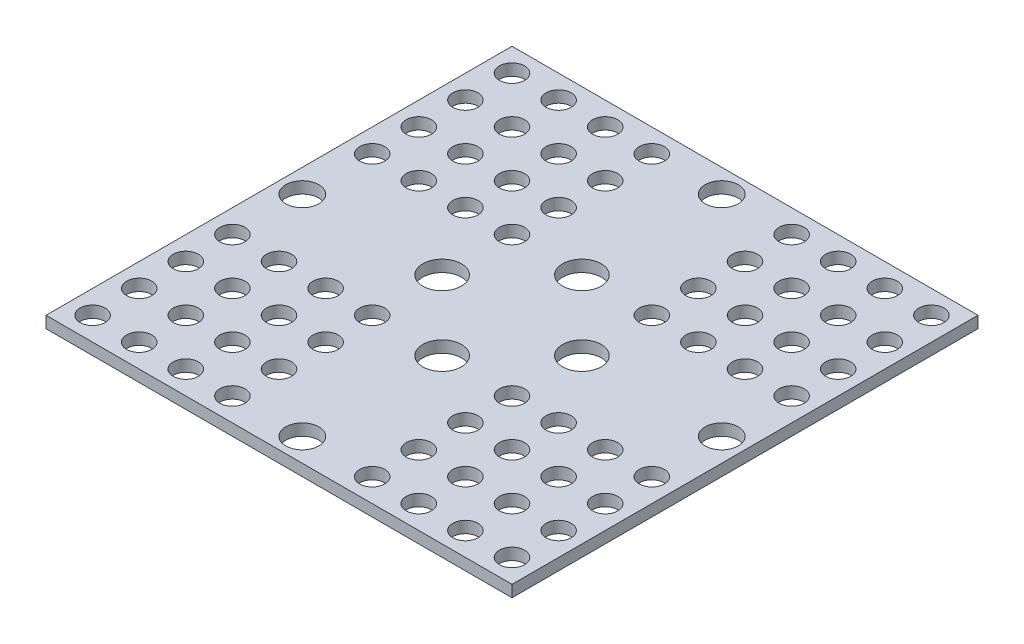
from build123d import *

# Parameters (mm, degrees)
SKETCH1_W           = 127
SKETCH1_H           = 127
SKETCH1_R           = 5.272810933
SKETCH1_R_2         = 4.510308164
SKETCH1_R_3         = 3.429
BOSS_EXTRUDE1_DEPTH = 3.175


with BuildPart() as part:
    # Sketch1 → Boss-Extrude1 (new body)
    with BuildSketch(Plane(origin=(0, 0, 0), x_dir=(1, 0, 0), z_dir=(0, 1, 0))):
        Rectangle(SKETCH1_W, SKETCH1_H)
        with Locations(Location((0, 19.05, 0), (0, 0, 270))):
            Circle(SKETCH1_R, mode=Mode.SUBTRACT)
        with Locations(Location((0, 57.15, 0), (0, 0, 270))):
            Circle(SKETCH1_R_2, mode=Mode.SUBTRACT)
        with Locations(Location((57.15, 0, 0), (0, 0, 90))):
            Circle(SKETCH1_R_2, mode=Mode.SUBTRACT)
        with Locations(Location((19.05, 0, 0), (0, 0, 90))):
            Circle(SKETCH1_R, mode=Mode.SUBTRACT)
        with Locations(Location((0, -19.05, 0), (0, 0, 270))):
            Circle(SKETCH1_R, mode=Mode.SUBTRACT)
        with Locations(Location((0, -57.15, 0), (0, 0, 270))):
            Circle(SKETCH1_R_2, mode=Mode.SUBTRACT)
        with Locations(Location((-57.15, 0, 0), (0, 0, 90))):
            Circle(SKETCH1_R_2, mode=Mode.SUBTRACT)
        with Locations(Location((-19.05, 0, 0), (0, 0, 90))):
            Circle(SKETCH1_R, mode=Mode.SUBTRACT)
        with Locations(Location((-57.15, 57.15, 0), (0, 0, 270))):
            Circle(SKETCH1_R_3, mode=Mode.SUBTRACT)
        with Locations(Location((-44.45, 57.15, 0), (0, 0, 270))):
            Circle(SKETCH1_R_3, mode=Mode.SUBTRACT)
        with Locations(Location((-31.75, 57.15, 0), (0, 0, 270))):
            Circle(SKETCH1_R_3, mode=Mode.SUBTRACT)
        with Locations(Location((-19.05, 57.15, 0), (0, 0, 270))):
            Circle(SKETCH1_R_3, mode=Mode.SUBTRACT)
        with Locations(Location((19.05, 57.15, 0), (0, 0, 270))):
            Circle(SKETCH1_R_3, mode=Mode.SUBTRACT)
        with Locations(Location((31.75, 57.15, 0), (0, 0, 270))):
            Circle(SKETCH1_R_3, mode=Mode.SUBTRACT)
        with Locations(Location((44.45, 57.15, 0), (0, 0, 270))):
            Circle(SKETCH1_R_3, mode=Mode.SUBTRACT)
        with Locations(Location((57.15, 57.15, 0), (0, 0, 270))):
            Circle(SKETCH1_R_3, mode=Mode.SUBTRACT)
        with Locations(Location((-44.45, 44.45, 0), (0, 0, 270))):
            Circle(SKETCH1_R_3, mode=Mode.SUBTRACT)
        with Locations(Location((-31.75, 44.45, 0), (0, 0, 270))):
            Circle(SKETCH1_R_3, mode=Mode.SUBTRACT)
        with Locations(Location((-19.05, 44.45, 0), (0, 0, 270))):
            Circle(SKETCH1_R_3, mode=Mode.SUBTRACT)
        with Locations(Location((19.05, 44.45, 0), (0, 0, 270))):
            Circle(SKETCH1_R_3, mode=Mode.SUBTRACT)
        with Locations(Location((31.75, 44.45, 0), (0, 0, 270))):
            Circle(SKETCH1_R_3, mode=Mode.SUBTRACT)
        with Locations(Location((44.45, 44.45, 0), (0, 0, 270))):
            Circle(SKETCH1_R_3, mode=Mode.SUBTRACT)
        with Locations(Location((57.15, 44.45, 0), (0, 0, 270))):
            Circle(SKETCH1_R_3, mode=Mode.SUBTRACT)
        with Locations(Location((-44.45, 31.75, 0), (0, 0, 270))):
            Circle(SKETCH1_R_3, mode=Mode.SUBTRACT)
        with Locations(Location((-31.75, 31.75, 0), (0, 0, 270))):
            Circle(SKETCH1_R_3, mode=Mode.SUBTRACT)
        with Locations(Location((-19.05, 31.75, 0), (0, 0, 270))):
            Circle(SKETCH1_R_3, mode=Mode.SUBTRACT)
        with Locations(Location((19.05, 31.75, 0), (0, 0, 270))):
            Circle(SKETCH1_R_3, mode=Mode.SUBTRACT)
        with Locations(Location((31.75, 31.75, 0), (0, 0, 270))):
            Circle(SKETCH1_R_3, mode=Mode.SUBTRACT)
        with Locations(Location((44.45, 31.75, 0), (0, 0, 270))):
            Circle(SKETCH1_R_3, mode=Mode.SUBTRACT)
        with Locations(Location((57.15, 31.75, 0), (0, 0, 270))):
            Circle(SKETCH1_R_3, mode=Mode.SUBTRACT)
        with Locations(Location((-44.45, 19.05, 0), (0, 0, 270))):
            Circle(SKETCH1_R_3, mode=Mode.SUBTRACT)
        with Locations(Location((-31.75, 19.05, 0), (0, 0, 270))):
            Circle(SKETCH1_R_3, mode=Mode.SUBTRACT)
        with Locations(Location((-19.05, 19.05, 0), (0, 0, 270))):
            Circle(SKETCH1_R_3, mode=Mode.SUBTRACT)
        with Locations(Location((19.05, 19.05, 0), (0, 0, 270))):
            Circle(SKETCH1_R_3, mode=Mode.SUBTRACT)
        with Locations(Location((31.75, 19.05, 0), (0, 0, 270))):
            Circle(SKETCH1_R_3, mode=Mode.SUBTRACT)
        with Locations(Location((44.45, 19.05, 0), (0, 0, 270))):
            Circle(SKETCH1_R_3, mode=Mode.SUBTRACT)
        with Locations(Location((57.15, 19.05, 0), (0, 0, 270))):
            Circle(SKETCH1_R_3, mode=Mode.SUBTRACT)
        with Locations(Location((-44.45, -19.05, 0), (0, 0, 270))):
            Circle(SKETCH1_R_3, mode=Mode.SUBTRACT)
        with Locations(Location((-31.75, -19.05, 0), (0, 0, 270))):
            Circle(SKETCH1_R_3, mode=Mode.SUBTRACT)
        with Locations(Location((-19.05, -19.05, 0), (0, 0, 270))):
            Circle(SKETCH1_R_3, mode=Mode.SUBTRACT)
        with Locations(Location((19.05, -19.05, 0), (0, 0, 270))):
            Circle(SKETCH1_R_3, mode=Mode.SUBTRACT)
        with Locations(Location((31.75, -19.05, 0), (0, 0, 270))):
            Circle(SKETCH1_R_3, mode=Mode.SUBTRACT)
        with Locations(Location((44.45, -19.05, 0), (0, 0, 270))):
            Circle(SKETCH1_R_3, mode=Mode.SUBTRACT)
        with Locations(Location((57.15, -19.05, 0), (0, 0, 270))):
            Circle(SKETCH1_R_3, mode=Mode.SUBTRACT)
        with Locations(Location((-44.45, -31.75, 0), (0, 0, 270))):
            Circle(SKETCH1_R_3, mode=Mode.SUBTRACT)
        with Locations(Location((-31.75, -31.75, 0), (0, 0, 270))):
            Circle(SKETCH1_R_3, mode=Mode.SUBTRACT)
        with Locations(Location((-19.05, -31.75, 0), (0, 0, 270))):
            Circle(SKETCH1_R_3, mode=Mode.SUBTRACT)
        with Locations(Location((19.05, -31.75, 0), (0, 0, 270))):
            Circle(SKETCH1_R_3, mode=Mode.SUBTRACT)
        with Locations(Location((31.75, -31.75, 0), (0, 0, 270))):
            Circle(SKETCH1_R_3, mode=Mode.SUBTRACT)
        with Locations(Location((44.45, -31.75, 0), (0, 0, 270))):
            Circle(SKETCH1_R_3, mode=Mode.SUBTRACT)
        with Locations(Location((57.15, -31.75, 0), (0, 0, 270))):
            Circle(SKETCH1_R_3, mode=Mode.SUBTRACT)
        with Locations(Location((-44.45, -44.45, 0), (0, 0, 270))):
            Circle(SKETCH1_R_3, mode=Mode.SUBTRACT)
        with Locations(Location((-31.75, -44.45, 0), (0, 0, 270))):
            Circle(SKETCH1_R_3, mode=Mode.SUBTRACT)
        with Locations(Location((-19.05, -44.45, 0), (0, 0, 270))):
            Circle(SKETCH1_R_3, mode=Mode.SUBTRACT)
        with Locations(Location((19.05, -44.45, 0), (0, 0, 270))):
            Circle(SKETCH1_R_3, mode=Mode.SUBTRACT)
        with Locations(Location((31.75, -44.45, 0), (0, 0, 270))):
            Circle(SKETCH1_R_3, mode=Mode.SUBTRACT)
        with Locations(Location((44.45, -44.45, 0), (0, 0, 270))):
            Circle(SKETCH1_R_3, mode=Mode.SUBTRACT)
        with Locations(Location((57.15, -44.45, 0), (0, 0, 270))):
            Circle(SKETCH1_R_3, mode=Mode.SUBTRACT)
        with Locations(Location((-44.45, -57.15, 0), (0, 0, 270))):
            Circle(SKETCH1_R_3, mode=Mode.SUBTRACT)
        with Locations(Location((-31.75, -57.15, 0), (0, 0, 270))):
            Circle(SKETCH1_R_3, mode=Mode.SUBTRACT)
        with Locations(Location((-19.05, -57.15, 0), (0, 0, 270))):
            Circle(SKETCH1_R_3, mode=Mode.SUBTRACT)
        with Locations(Location((19.05, -57.15, 0), (0, 0, 270))):
            Circle(SKETCH1_R_3, mode=Mode.SUBTRACT)
        with Locations(Location((31.75, -57.15, 0), (0, 0, 270))):
            Circle(SKETCH1_R_3, mode=Mode.SUBTRACT)
        with Locations(Location((44.45, -57.15, 0), (0, 0, 270))):
            Circle(SKETCH1_R_3, mode=Mode.SUBTRACT)
        with Locations(Location((57.15, -57.15, 0), (0, 0, 270))):
            Circle(SKETCH1_R_3, mode=Mode.SUBTRACT)
        with Locations(Location((-57.15, 44.45, 0), (0, 0, 270))):
            Circle(SKETCH1_R_3, mode=Mode.SUBTRACT)
        with Locations(Location((-57.15, 31.75, 0), (0, 0, 270))):
            Circle(SKETCH1_R_3, mode=Mode.SUBTRACT)
        with Locations(Location((-57.15, 19.05, 0), (0, 0, 270))):
            Circle(SKETCH1_R_3, mode=Mode.SUBTRACT)
        with Locations(Location((-57.15, -19.05, 0), (0, 0, 270))):
            Circle(SKETCH1_R_3, mode=Mode.SUBTRACT)
        with Locations(Location((-57.15, -31.75, 0), (0, 0, 270))):
            Circle(SKETCH1_R_3, mode=Mode.SUBTRACT)
        with Locations(Location((-57.15, -44.45, 0), (0, 0, 270))):
            Circle(SKETCH1_R_3, mode=Mode.SUBTRACT)
        with Locations(Location((-57.15, -57.15, 0), (0, 0, 270))):
            Circle(SKETCH1_R_3, mode=Mode.SUBTRACT)
    extrude(amount=BOSS_EXTRUDE1_DEPTH)


solid = part.part
